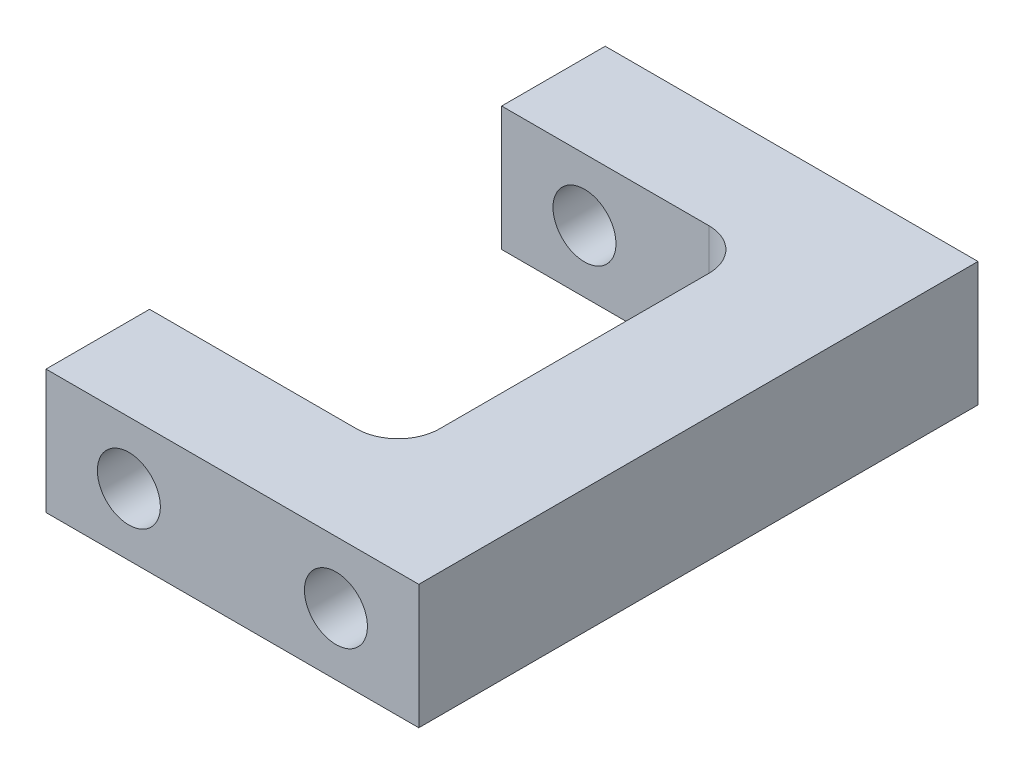
from build123d import *

# Parameters (mm, degrees)
SKETCH1_W           = 90
SKETCH1_H           = 30
BOSS_EXTRUDE1_DEPTH = 25
SKETCH2_W           = 110
SKETCH2_H           = 30
BOSS_EXTRUDE2_DEPTH = 30
BOSS_EXTRUDE3_START = -90
SKETCH3_W           = 25
SKETCH3_H           = 30
BOSS_EXTRUDE3_DEPTH = 90
SKETCH4_R           = 7.6
CUT_EXTRUDE1_DEPTH  = 144.090880213
FILLET1_R           = 10


with BuildPart() as part:
    # Sketch1 → Boss-Extrude1 (new body)
    with BuildSketch(Plane.XY):
        Rectangle(SKETCH1_W, SKETCH1_H)
    extrude(amount=BOSS_EXTRUDE1_DEPTH)

    # Sketch2 → Boss-Extrude2 (add)
    with BuildSketch(Plane(origin=(45, 0, 0), x_dir=(0, 0, -1), z_dir=(1, 0, 0))):
        with Locations((-55, 0)):
            Rectangle(SKETCH2_W, SKETCH2_H)
    extrude(amount=-BOSS_EXTRUDE2_DEPTH)

    # Sketch3 → Boss-Extrude3 (add)
    with BuildSketch(Plane(origin=(45, 0, 0), x_dir=(0, 0, -1), z_dir=(1, 0, 0)).offset(BOSS_EXTRUDE3_START)):
        with Locations((-122.5, 0)):
            Rectangle(SKETCH3_W, SKETCH3_H)
    extrude(amount=BOSS_EXTRUDE3_DEPTH)

    # Sketch4 → Cut-Extrude1 (cut, through all)
    with BuildSketch(Plane(origin=(0, 0, 0), x_dir=(-1, 0, 0), z_dir=(0, 0, -1))):
        with Locations((25, 0)):
            Circle(SKETCH4_R)
        with Locations((-25, 0)):
            Circle(SKETCH4_R)
    extrude(amount=-CUT_EXTRUDE1_DEPTH, mode=Mode.SUBTRACT)

    # Fillet1
    fillet1_edges = [part.edges().sort_by_distance(p)[0] for p in [
        (15, 0, 25),
        (15, 0, 110),
    ]]
    fillet(fillet1_edges, radius=FILLET1_R)


solid = part.part
